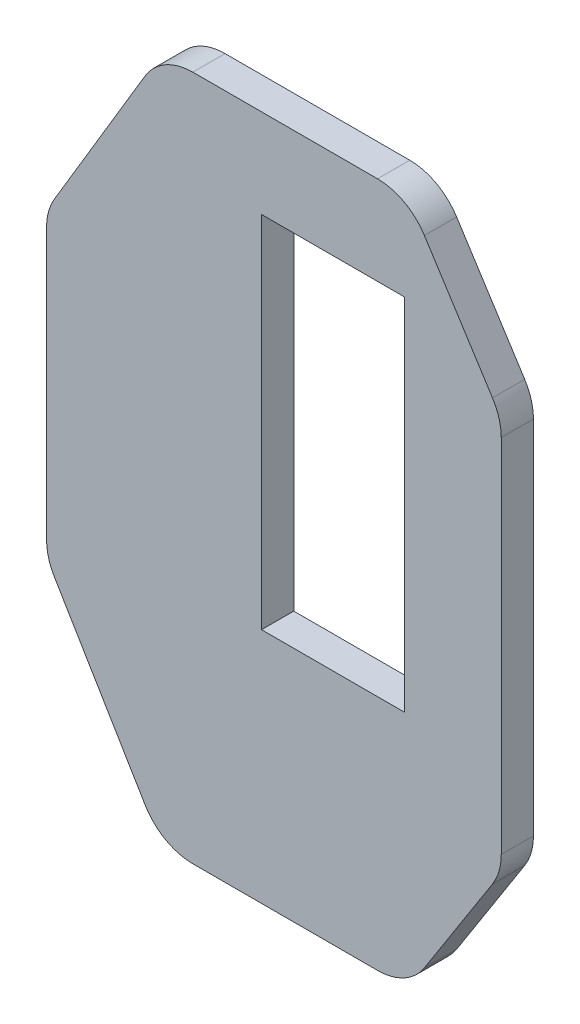
from build123d import *

# Parameters (mm, degrees)
SKETCH_1_W      = 13.300240072
SKETCH_1_H      = 33.5
EXTRUDE_1_DEPTH = 3


with BuildPart() as part:
    # ｽｹｯﾁ1 → ﾎﾞｽ - 押し出し1 (new body)
    with BuildSketch(Plane.XY):
        with BuildLine():
            Line((-1.634343126, 16.855350031), (-7.977588702, 26.788033743))
            ThreePointArc((-7.977588702, 26.788033743), (-9.854266456, 28.542819322), (-12.343280841, 29.18))
            Line((-12.343280841, 29.18), (-29.549149223, 29.18))
            ThreePointArc((-29.549149223, 29.18), (-32.106762662, 28.50455475), (-33.997376931, 26.654368145))
            Line((-33.997376931, 26.654368145), (-42.448262973, 12.492253701))
            ThreePointArc((-42.448262973, 12.492253701), (-42.993742281, 11.214580959), (-43.180035265, 9.837885555))
            Line((-43.180035265, 9.837885555), (-43.180035265, -15.34473303))
            ThreePointArc((-43.180035265, -15.34473303), (-42.993742281, -16.721428434), (-42.448262973, -17.999101176))
            Line((-42.448262973, -17.999101176), (-33.997376931, -32.16121562))
            ThreePointArc((-33.997376931, -32.16121562), (-32.106762662, -34.011402225), (-29.549149223, -34.686847475))
            Line((-29.549149223, -34.686847475), (-12.343280841, -34.686847475))
            ThreePointArc((-12.343280841, -34.686847475), (-9.854266456, -34.049666797), (-7.977588702, -32.294881217))
            Line((-7.977588702, -32.294881217), (-1.634343126, -22.362197506))
            ThreePointArc((-1.634343126, -22.362197506), (-1.027777967, -21.026423162), (-0.820035265, -19.574163763))
            Line((-0.820035265, -19.574163763), (-0.820035265, 14.067316288))
            ThreePointArc((-0.820035265, 14.067316288), (-1.027777967, 15.519575687), (-1.634343126, 16.855350031))
        make_face()
        with Locations((-16.499940321, 4.15)):
            Rectangle(SKETCH_1_W, SKETCH_1_H, mode=Mode.SUBTRACT)
    extrude(amount=EXTRUDE_1_DEPTH)


solid = part.part
